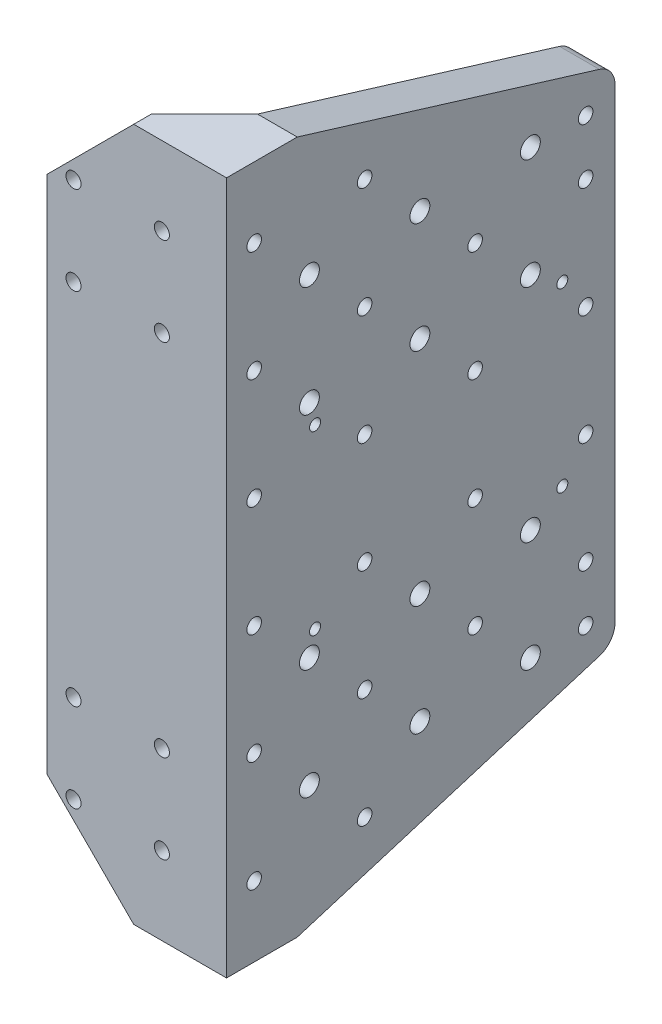
from build123d import *

# Parameters (mm, degrees)
ESQUISSE1_W                     = 40.624989268
ESQUISSE1_H                     = 156.8
BOSS_EXTRU_1_DEPTH              = 4
ESQUISSE2_W                     = 9
ESQUISSE2_H                     = 156.8
BOSS_EXTRU_2_DEPTH              = 83.900004333
ESQUISSE3_W                     = 80.400004333
ESQUISSE3_H                     = 50
ENL_V_MAT_EXTRU_1_DEPTH         = 4
CONG_1_R                        = 5
D_GAGEMENT_M31_D                = 3.4
BOSS_EXTRU_3_DEPTH              = 4
ENL_V_MAT_EXTRU_2_DEPTH         = 156.924377041
ENL_V_MAT_EXTRU_3_DEPTH         = 160.236963297
TROU_TARAUD_M3X0_51_D           = 2.5
TROU_TARAUD_M4X0_71_D           = 3.3
R_P_TITION_LIN_AIRE1_COUNT      = 4
R_P_TITION_LIN_AIRE1_PITCH      = 25
R_P_TITION_LIN_AIRE1_COUNT_DIR2 = 3
R_P_TITION_LIN_AIRE1_PITCH_DIR2 = 25
D_GAGEMENT_M42_D                = 4.5
R_P_TITION_LIN_AIRE2_COUNT      = 3
R_P_TITION_LIN_AIRE2_PITCH      = 25
R_P_TITION_LIN_AIRE2_COUNT_DIR2 = 2
R_P_TITION_LIN_AIRE2_PITCH_DIR2 = 25
TROU_TARAUD_M4X0_72_D           = 3.3
SYM_TRIE2_COPY_1_D              = 3.3
SYM_TRIE2_COPY_2_D              = 3.3
SYM_TRIE2_COPY_3_D              = 3.3
SYM_TRIE2_COPY_4_D              = 3.3
SYM_TRIE2_COPY_5_D              = 3.3
SYM_TRIE2_COPY_6_D              = 3.3
SYM_TRIE2_COPY_7_D              = 3.3
SYM_TRIE2_COPY_8_D              = 3.3
SYM_TRIE2_COPY_9_D              = 3.3
SYM_TRIE2_COPY_10_D             = 4.5
SYM_TRIE2_COPY_11_D             = 4.5
SYM_TRIE2_COPY_12_D             = 4.5
SYM_TRIE2_COPY_13_D             = 4.5
SYM_TRIE2_COPY_14_D             = 4.5
CONG_2_R                        = 5


with BuildPart() as part:
    # Esquisse1 → Boss.-Extru.1 (new body)
    with BuildSketch(Plane.XY):
        with Locations((4.312505437, 50.7)):
            Rectangle(ESQUISSE1_W, ESQUISSE1_H)
    extrude(amount=BOSS_EXTRU_1_DEPTH)

    # Esquisse2 → Boss.-Extru.2 (add)
    with BuildSketch(Plane(origin=(0, 0, 0), x_dir=(-1, 0, 0), z_dir=(0, 0, -1))):
        with Locations((-20.125000071, 50.7)):
            Rectangle(ESQUISSE2_W, ESQUISSE2_H)
    extrude(amount=BOSS_EXTRU_2_DEPTH)

    # Esquisse3 → Enlèv. mat.-Extru.1 (cut)
    with BuildSketch(Plane.ZY.offset(-15.625000071)):
        with Locations((-43.700002166, 50.7)):
            Rectangle(ESQUISSE3_W, ESQUISSE3_H)
    extrude(amount=-ENL_V_MAT_EXTRU_1_DEPTH, mode=Mode.SUBTRACT)

    # Congé1
    cong_1_edges = [part.edges().sort_by_distance(p)[0] for p in [
        (17.625000071, 75.7, -3.5),
        (17.625000071, 25.7, -3.5),
    ]]
    fillet(cong_1_edges, radius=CONG_1_R)

    # Dégagement M31 (through all)
    with Locations(Plane.XY.offset(4)):
        with Locations((-10, -10), (-10, 10), (10, 10), (10, -10)):
            d_gagement_m31 = Hole(D_GAGEMENT_M31_D / 2)

    # Symétrie1: Dégagement M31 across plane
    add(d_gagement_m31.mirror(Plane.ZX.offset(50.7)), mode=Mode.SUBTRACT)

    # Esquisse8 → Boss.-Extru.3 (add)
    with BuildSketch(Plane(origin=(0, 129.1, 0), x_dir=(1, 0, 0), z_dir=(0, 1, 0))):
        Polygon((3.625000071, 0), (15.625000071, 12), (15.625000071, 0), align=None)
    boss_extru_3 = extrude(amount=-BOSS_EXTRU_3_DEPTH)

    # Esquisse10 → Enlèv. mat.-Extru.2 (cut, through all)
    with BuildSketch(Plane(origin=(0, 0, 0), x_dir=(-1, 0, 0), z_dir=(0, 0, -1))):
        Polygon((-3.625000071, 129.1), (15.999989197, 109.475010732), (15.999989197, 129.1), align=None)
    enl_v_mat_extru_2 = extrude(amount=-ENL_V_MAT_EXTRU_2_DEPTH, mode=Mode.SUBTRACT)

    # Esquisse11 → Enlèv. mat.-Extru.3 (cut, through all)
    with BuildSketch(Plane(origin=(24.625000071, 0, 0), x_dir=(0, 0, -1), z_dir=(1, 0, 0))):
        Polygon((83.900004333, 107.1), (12, 129.1), (83.900004333, 129.1), align=None)
    enl_v_mat_extru_3 = extrude(amount=-ENL_V_MAT_EXTRU_3_DEPTH, mode=Mode.SUBTRACT)

    # Trou taraudé M3x0.51 (through all)
    with Locations(Plane(origin=(24.625000071, 70.7, -71.970004333), x_dir=(0, 0, 1), z_dir=(1, 0, 0))):
        with Locations((0, 0), (0, 40), (55.94, 0), (55.94, 40)):
            Hole(TROU_TARAUD_M3X0_51_D / 2)

    # Trou taraudé M4x0.71 (through all)
    with Locations(Plane(origin=(24.625000071, 63.2, -2.25), x_dir=(0, 0, 1), z_dir=(1, 0, 0))):
        with Locations((0, 0)):
            trou_taraud_m4x0_71 = Hole(TROU_TARAUD_M4X0_71_D / 2)

    # Répétition linéaire1: Trou taraud_ M4x0.71 4 × 3, 2 skipped
    with Locations(*[(0, j * R_P_TITION_LIN_AIRE1_PITCH_DIR2, -i * R_P_TITION_LIN_AIRE1_PITCH) for i in range(R_P_TITION_LIN_AIRE1_COUNT) for j in range(R_P_TITION_LIN_AIRE1_COUNT_DIR2) if (i, j) not in ((0, 0), (2, 2), (3, 2))]):
        add(trou_taraud_m4x0_71, mode=Mode.SUBTRACT)

    # Dégagement M42 (through all)
    with Locations(Plane(origin=(24.625000071, 75.7, -14.75), x_dir=(0, 0, 1), z_dir=(1, 0, 0))):
        with Locations((0, 0)):
            d_gagement_m42 = Hole(D_GAGEMENT_M42_D / 2)

    # Répétition linéaire2: D_gagement M42 3 × 2
    with Locations(*[(0, j * R_P_TITION_LIN_AIRE2_PITCH_DIR2, -i * R_P_TITION_LIN_AIRE2_PITCH) for i in range(R_P_TITION_LIN_AIRE2_COUNT) for j in range(R_P_TITION_LIN_AIRE2_COUNT_DIR2) if (i, j) != (0, 0)]):
        add(d_gagement_m42, mode=Mode.SUBTRACT)

    # Trou taraudé M4x0.72 (through all)
    with Locations(Plane(origin=(24.625000071, 100.7, -77.25), x_dir=(0, 0, 1), z_dir=(1, 0, 0))):
        with Locations((0, 0)):
            trou_taraud_m4x0_72 = Hole(TROU_TARAUD_M4X0_72_D / 2)

    # Symétrie2: Boss.-Extru.3, Enlèv. mat.-Extru.2, Enlèv. mat.-Extru.3, Trou taraudé M4x0.71, Dégagement M42, Trou taraudé M4x0.72 across plane
    add(boss_extru_3.mirror(Plane.ZX.offset(50.7)))
    add(enl_v_mat_extru_2.mirror(Plane.ZX.offset(50.7)), mode=Mode.SUBTRACT)
    add(enl_v_mat_extru_3.mirror(Plane.ZX.offset(50.7)), mode=Mode.SUBTRACT)
    add(trou_taraud_m4x0_71.mirror(Plane.ZX.offset(50.7)), mode=Mode.SUBTRACT)
    add(d_gagement_m42.mirror(Plane.ZX.offset(50.7)), mode=Mode.SUBTRACT)
    add(trou_taraud_m4x0_72.mirror(Plane.ZX.offset(50.7)), mode=Mode.SUBTRACT)

    # Symétrie2 copy 1 (through all)
    with Locations(Plane(origin=(24.625000071, 13.2, -2.25), x_dir=(0, 0, 1), z_dir=(1, 0, 0))):
        with Locations((0, 0)):
            Hole(SYM_TRIE2_COPY_1_D / 2)

    # Symétrie2 copy 2 (through all)
    with Locations(Plane(origin=(24.625000071, -11.8, -2.25), x_dir=(0, 0, 1), z_dir=(1, 0, 0))):
        with Locations((0, 0)):
            Hole(SYM_TRIE2_COPY_2_D / 2)

    # Symétrie2 copy 3 (through all)
    with Locations(Plane(origin=(24.625000071, 38.2, -27.25), x_dir=(0, 0, 1), z_dir=(1, 0, 0))):
        with Locations((0, 0)):
            Hole(SYM_TRIE2_COPY_3_D / 2)

    # Symétrie2 copy 4 (through all)
    with Locations(Plane(origin=(24.625000071, 13.2, -27.25), x_dir=(0, 0, 1), z_dir=(1, 0, 0))):
        with Locations((0, 0)):
            Hole(SYM_TRIE2_COPY_4_D / 2)

    # Symétrie2 copy 5 (through all)
    with Locations(Plane(origin=(24.625000071, -11.8, -27.25), x_dir=(0, 0, 1), z_dir=(1, 0, 0))):
        with Locations((0, 0)):
            Hole(SYM_TRIE2_COPY_5_D / 2)

    # Symétrie2 copy 6 (through all)
    with Locations(Plane(origin=(24.625000071, 38.2, -52.25), x_dir=(0, 0, 1), z_dir=(1, 0, 0))):
        with Locations((0, 0)):
            Hole(SYM_TRIE2_COPY_6_D / 2)

    # Symétrie2 copy 7 (through all)
    with Locations(Plane(origin=(24.625000071, 13.2, -52.25), x_dir=(0, 0, 1), z_dir=(1, 0, 0))):
        with Locations((0, 0)):
            Hole(SYM_TRIE2_COPY_7_D / 2)

    # Symétrie2 copy 8 (through all)
    with Locations(Plane(origin=(24.625000071, 38.2, -77.25), x_dir=(0, 0, 1), z_dir=(1, 0, 0))):
        with Locations((0, 0)):
            Hole(SYM_TRIE2_COPY_8_D / 2)

    # Symétrie2 copy 9 (through all)
    with Locations(Plane(origin=(24.625000071, 13.2, -77.25), x_dir=(0, 0, 1), z_dir=(1, 0, 0))):
        with Locations((0, 0)):
            Hole(SYM_TRIE2_COPY_9_D / 2)

    # Symétrie2 copy 10 (through all)
    with Locations(Plane(origin=(24.625000071, 0.7, -14.75), x_dir=(0, 0, 1), z_dir=(1, 0, 0))):
        with Locations((0, 0)):
            Hole(SYM_TRIE2_COPY_10_D / 2)

    # Symétrie2 copy 11 (through all)
    with Locations(Plane(origin=(24.625000071, 25.7, -39.75), x_dir=(0, 0, 1), z_dir=(1, 0, 0))):
        with Locations((0, 0)):
            Hole(SYM_TRIE2_COPY_11_D / 2)

    # Symétrie2 copy 12 (through all)
    with Locations(Plane(origin=(24.625000071, 0.7, -39.75), x_dir=(0, 0, 1), z_dir=(1, 0, 0))):
        with Locations((0, 0)):
            Hole(SYM_TRIE2_COPY_12_D / 2)

    # Symétrie2 copy 13 (through all)
    with Locations(Plane(origin=(24.625000071, 25.7, -64.75), x_dir=(0, 0, 1), z_dir=(1, 0, 0))):
        with Locations((0, 0)):
            Hole(SYM_TRIE2_COPY_13_D / 2)

    # Symétrie2 copy 14 (through all)
    with Locations(Plane(origin=(24.625000071, 0.7, -64.75), x_dir=(0, 0, 1), z_dir=(1, 0, 0))):
        with Locations((0, 0)):
            Hole(SYM_TRIE2_COPY_14_D / 2)

    # Congé2
    cong_2_edges = [part.edges().sort_by_distance(p)[0] for p in [
        (20.125000071, 107.1, -83.900004333),
        (20.125000071, -5.7, -83.900004333),
    ]]
    fillet(cong_2_edges, radius=CONG_2_R)


solid = part.part
